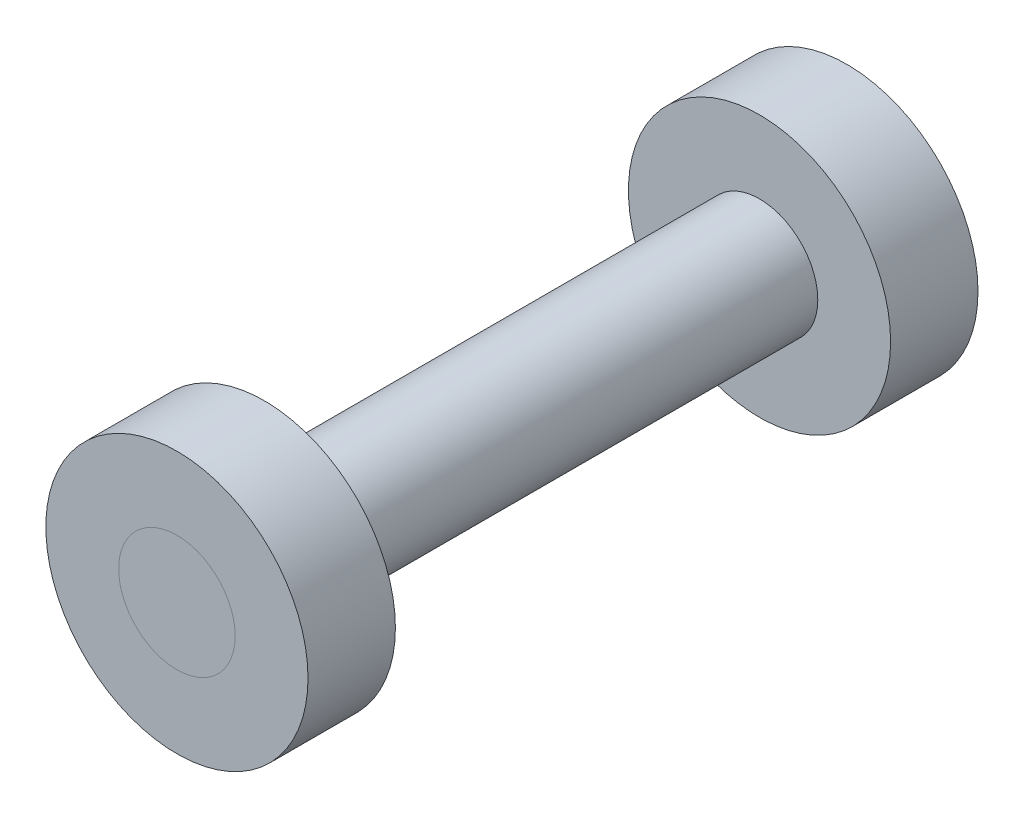
from build123d import *

# Parameters (mm, degrees)
CROQUIS1_R              = 4.5
SALIENTE_EXTRUIR1_DEPTH = 3
CROQUIS2_R              = 2
SALIENTE_EXTRUIR2_DEPTH = 23
SALIENTE_EXTRUIR3_START = 20
CROQUIS4_R              = 4.5
CROQUIS4_R_2            = 2
SALIENTE_EXTRUIR3_DEPTH = 3


with BuildPart() as part:
    # Croquis1 → Saliente-Extruir1 (new body)
    with BuildSketch(Plane.XY):
        Circle(CROQUIS1_R)
    extrude(amount=SALIENTE_EXTRUIR1_DEPTH)

    # Croquis2 → Saliente-Extruir2 (add)
    with BuildSketch(Plane.XY):
        Circle(CROQUIS2_R)
    extrude(amount=SALIENTE_EXTRUIR2_DEPTH)


with BuildPart() as body_2:
    # Croquis4 → Saliente-Extruir3 (new body)
    with BuildSketch(Plane.XY.offset(SALIENTE_EXTRUIR3_START)):
        Circle(CROQUIS4_R)
        Circle(CROQUIS4_R_2, mode=Mode.SUBTRACT)
    extrude(amount=SALIENTE_EXTRUIR3_DEPTH)


solid = Compound([part.part, body_2.part])
